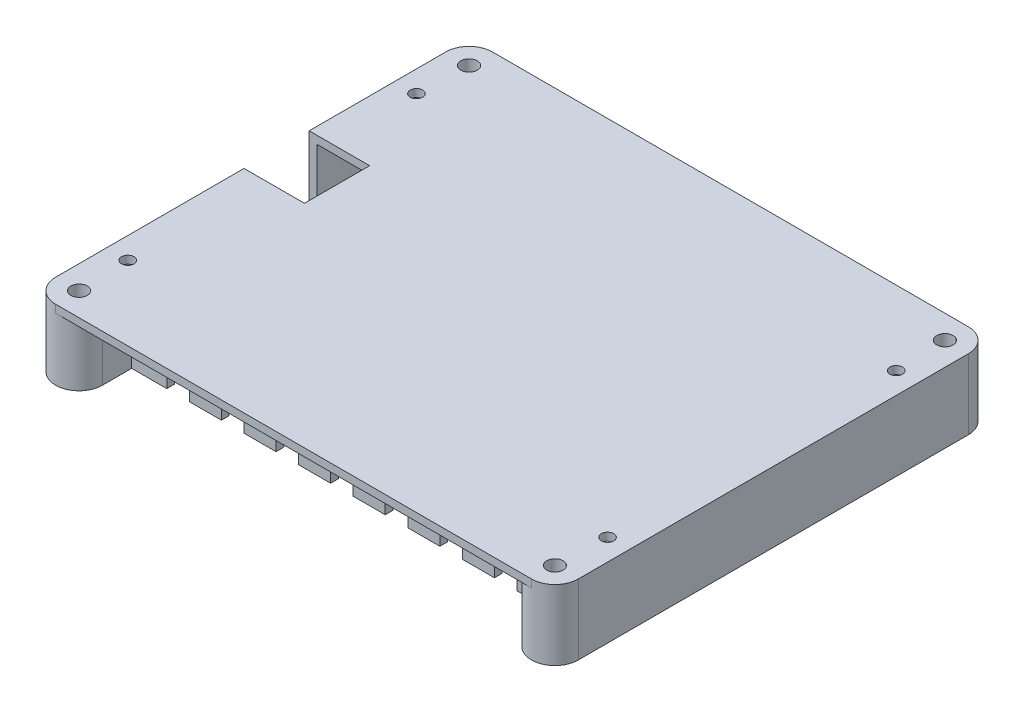
from build123d import *

# Parameters (mm, degrees)
SKETCH_1_R          = 2.1
EXTRUDE_1_DEPTH     = 16
SKETCH_2_R          = 2.1
EXTRUDE_2_DEPTH     = 2
EXTRUDE_START       = -2
EXTRUDE_3_DEPTH     = 2
SKETCH_4_W          = 5.8
SKETCH_4_H          = 13.4
CUT_EXTRUDE_1_DEPTH = 2
SKETCH_5_W          = 9
SKETCH_5_H          = 11
CUT_EXTRUDE_2_DEPTH = 2
SKETCH_6_W          = 16.7
SKETCH_6_H          = 18
CUT_EXTRUDE_3_DEPTH = 15.5
SKETCH_7_R          = 1.6
CUT_EXTRUDE_4_DEPTH = 2


with BuildPart() as part:
    # 草图1 → 凸台-拉伸1 (new body)
    with BuildSketch(Plane(origin=(0, 0, 0), x_dir=(1, 0, 0), z_dir=(0, 1, 0))):
        with BuildLine():
            Line((41.776260997, -10), (41.776260997, -2.5))
            Line((41.776260997, -2.5), (151.776260997, -2.5))
            Line((151.776260997, -2.5), (151.776260997, -10))
            ThreePointArc((151.776260997, -10), (153.53362031, -14.242640687), (157.776260997, -16))
            ThreePointArc((157.776260997, -16), (162.018901684, -14.242640687), (163.776260997, -10))
            Line((163.776260997, -10), (163.776260997, 90))
            ThreePointArc((163.776260997, 90), (162.018901684, 94.242640687), (157.776260997, 96))
            Line((157.776260997, 96), (35.776260997, 96))
            ThreePointArc((35.776260997, 96), (31.53362031, 94.242640687), (29.776260997, 90))
            Line((29.776260997, 90), (29.776260997, -10))
            ThreePointArc((29.776260997, -10), (31.53362031, -14.242640687), (35.776260997, -16))
            ThreePointArc((35.776260997, -16), (40.018901684, -14.242640687), (41.776260997, -10))
        make_face()
        with Locations(Location((35.776260997, -10, 0), (0, 0, 270))):
            Circle(SKETCH_1_R, mode=Mode.SUBTRACT)
        with Locations(Location((35.776260997, 90, 0), (0, 0, 270))):
            Circle(SKETCH_1_R, mode=Mode.SUBTRACT)
        with Locations(Location((157.776260997, 90, 0), (0, 0, 270))):
            Circle(SKETCH_1_R, mode=Mode.SUBTRACT)
        with Locations(Location((157.776260997, -10, 0), (0, 0, 270))):
            Circle(SKETCH_1_R, mode=Mode.SUBTRACT)
        with BuildLine():
            Line((31.776260997, -0.5), (161.776260997, -0.5))
            Line((161.776260997, -0.5), (161.776260997, 80.5))
            Line((161.776260997, 80.5), (157.776260997, 80.5))
            Line((157.776260997, 80.5), (157.776260997, 84))
            ThreePointArc((157.776260997, 84), (152.299035422, 87.550510257), (153.304125042, 94))
            Line((153.304125042, 94), (96.776260997, 94))
            Line((96.776260997, 94), (40.248396952, 94))
            ThreePointArc((40.248396952, 94), (41.253486572, 87.550510257), (35.776260997, 84))
            Line((35.776260997, 84), (35.776260997, 80.5))
            Line((35.776260997, 80.5), (31.776260997, 80.5))
            Line((31.776260997, 80.5), (31.776260997, -0.5))
        make_face(mode=Mode.SUBTRACT)
    extrude(amount=EXTRUDE_1_DEPTH)

    # 草图2 → 凸台-拉伸2 (add)
    with BuildSketch(Plane(origin=(0, 16, 0), x_dir=(1, 0, 0), z_dir=(0, 1, 0))):
        with BuildLine():
            Line((29.776260997, 90), (29.776260997, -10))
            ThreePointArc((29.776260997, -10), (35.776260997, -16), (41.776260997, -10))
            Line((41.776260997, -10), (41.776260997, -2.5))
            Line((41.776260997, -2.5), (151.776260997, -2.5))
            Line((151.776260997, -2.5), (151.776260997, -10))
            ThreePointArc((151.776260997, -10), (157.776260997, -16), (163.776260997, -10))
            Line((163.776260997, -10), (163.776260997, 90))
            ThreePointArc((163.776260997, 90), (162.018901684, 94.242640687), (157.776260997, 96))
            Line((157.776260997, 96), (35.776260997, 96))
            ThreePointArc((35.776260997, 96), (31.53362031, 94.242640687), (29.776260997, 90))
        make_face()
        with Locations(Location((35.776260997, 90, 0), (0, 0, 270))):
            Circle(SKETCH_2_R, mode=Mode.SUBTRACT)
        with Locations(Location((157.776260997, 90, 0), (0, 0, 270))):
            Circle(SKETCH_2_R, mode=Mode.SUBTRACT)
        with Locations(Location((35.776260997, -10, 0), (0, 0, 270))):
            Circle(SKETCH_2_R, mode=Mode.SUBTRACT)
        with Locations(Location((157.776260997, -10, 0), (0, 0, 270))):
            Circle(SKETCH_2_R, mode=Mode.SUBTRACT)
    extrude(amount=EXTRUDE_2_DEPTH)

    # 草图3 → 凸台-拉伸3 (add)
    with BuildSketch(Plane(origin=(0, 18, 0), x_dir=(1, 0, 0), z_dir=(0, 1, 0)).offset(EXTRUDE_START)):
        with BuildLine():
            Line((41.776260997, -2.5), (151.776260997, -2.5))
            Line((151.776260997, -2.5), (151.776260997, -10))
            ThreePointArc((151.776260997, -10), (153.53362031, -14.242640687), (157.776260997, -16))
            Line((157.776260997, -16), (35.776260997, -16))
            ThreePointArc((35.776260997, -16), (40.018901684, -14.242640687), (41.776260997, -10))
            Line((41.776260997, -10), (41.776260997, -2.5))
        make_face()
    extrude(amount=EXTRUDE_3_DEPTH)

    # 草图4 → 切除-拉伸1 (cut)
    with BuildSketch(Plane.XY.offset(2.5)):
        with Locations((67.676260997, 6.7)):
            Rectangle(SKETCH_4_W, SKETCH_4_H)
        with Locations((53.676260997, 6.7)):
            Rectangle(SKETCH_4_W, SKETCH_4_H)
        with Locations((81.676260997, 6.7)):
            Rectangle(SKETCH_4_W, SKETCH_4_H)
        with Locations((95.676260997, 6.7)):
            Rectangle(SKETCH_4_W, SKETCH_4_H)
        with Locations((109.676260997, 6.7)):
            Rectangle(SKETCH_4_W, SKETCH_4_H)
        with Locations((123.676260997, 6.7)):
            Rectangle(SKETCH_4_W, SKETCH_4_H)
        with Locations((137.676260997, 6.7)):
            Rectangle(SKETCH_4_W, SKETCH_4_H)
    extrude(amount=-CUT_EXTRUDE_1_DEPTH, mode=Mode.SUBTRACT)

    # 草图5 → 切除-拉伸2 (cut)
    with BuildSketch(Plane.ZY.offset(-29.776260997)):
        with Locations((-23, 5.5)):
            Rectangle(SKETCH_5_W, SKETCH_5_H)
    extrude(amount=-CUT_EXTRUDE_2_DEPTH, mode=Mode.SUBTRACT)

    # 草图6 → 切除-拉伸3 (cut)
    with BuildSketch(Plane.ZY.offset(-29.776260997)):
        with Locations((-46.65, 9)):
            Rectangle(SKETCH_6_W, SKETCH_6_H)
    extrude(amount=-CUT_EXTRUDE_3_DEPTH, mode=Mode.SUBTRACT)

    # 草图7 → 切除-拉伸4 (cut)
    with BuildSketch(Plane(origin=(0, 18, 0), x_dir=(1, 0, 0), z_dir=(0, 1, 0))):
        with Locations(Location((158.276260997, 77, 0), (0, 0, 270))):
            Circle(SKETCH_7_R)
        with Locations(Location((35.276260997, 77, 0), (0, 0, 270))):
            Circle(SKETCH_7_R)
        with Locations(Location((35.276260997, 3, 0), (0, 0, 270))):
            Circle(SKETCH_7_R)
        with Locations(Location((158.276260997, 3, 0), (0, 0, 270))):
            Circle(SKETCH_7_R)
    extrude(amount=-CUT_EXTRUDE_4_DEPTH, mode=Mode.SUBTRACT)


solid = part.part
